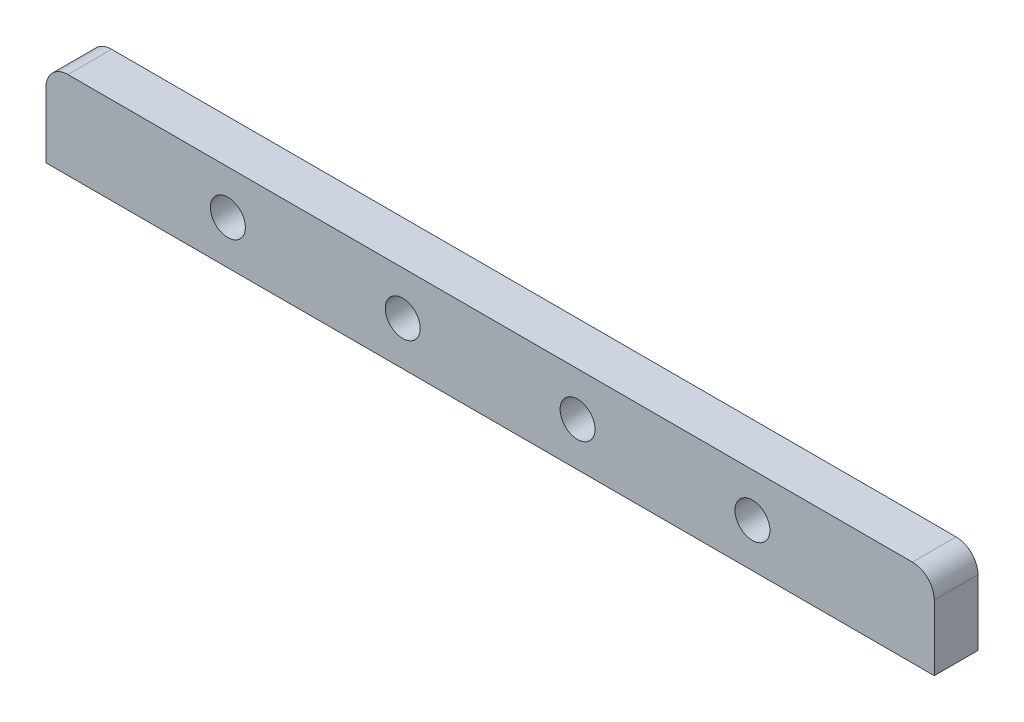
from build123d import *

# Parameters (mm, degrees)
SKETCH1_W           = 101.6
SKETCH1_H           = 10
BOSS_EXTRUDE1_DEPTH = 5
SKETCH2_R           = 2
CUT_EXTRUDE1_DEPTH  = 5
FILLET1_R           = 2.5


with BuildPart() as part:
    # Sketch1 → Boss-Extrude1 (new body)
    with BuildSketch(Plane.XY):
        with Locations((0, 5)):
            Rectangle(SKETCH1_W, SKETCH1_H)
    extrude(amount=BOSS_EXTRUDE1_DEPTH)

    # Sketch2 → Cut-Extrude1 (cut)
    with BuildSketch(Plane.XY.offset(5)):
        with Locations((-30, 5)):
            Circle(SKETCH2_R)
        with Locations((-10, 5)):
            Circle(SKETCH2_R)
        with Locations((10, 5)):
            Circle(SKETCH2_R)
        with Locations((30, 5)):
            Circle(SKETCH2_R)
    extrude(amount=-CUT_EXTRUDE1_DEPTH, mode=Mode.SUBTRACT)

    # Fillet1
    fillet1_edges = [part.edges().sort_by_distance(p)[0] for p in [
        (-50.8, 10, 2.5),
        (50.8, 10, 2.5),
    ]]
    fillet(fillet1_edges, radius=FILLET1_R)


solid = part.part
